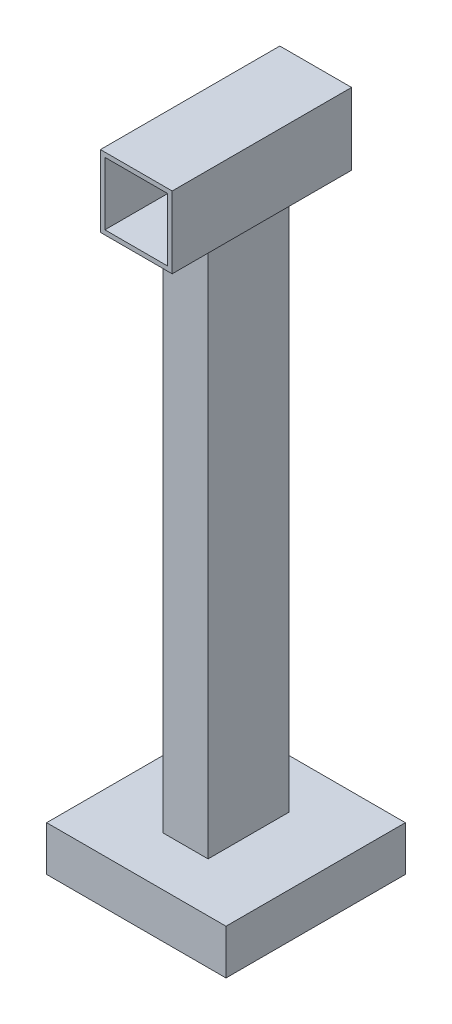
from build123d import *

# Parameters (mm, degrees)
ESQUISSE2_W        = 40
ESQUISSE2_H        = 40
ESQUISSE2_W_2      = 35
ESQUISSE2_H_2      = 35
BOSS_EXTRU_1_DEPTH = 100
ESQUISSE3_W        = 25
ESQUISSE3_H        = 45
BOSS_EXTRU_2_DEPTH = 300
ESQUISSE4_W        = 100
ESQUISSE4_H        = 100
BOSS_EXTRU_3_DEPTH = 25


with BuildPart() as part:
    # Esquisse2 → Boss.-Extru.1 (new body)
    with BuildSketch(Plane.XY):
        Rectangle(ESQUISSE2_W, ESQUISSE2_H)
        Rectangle(ESQUISSE2_W_2, ESQUISSE2_H_2, mode=Mode.SUBTRACT)
    extrude(amount=BOSS_EXTRU_1_DEPTH)

    # Esquisse3 → Boss.-Extru.2 (add)
    with BuildSketch(Plane.XZ.offset(20)):
        with Locations((0, 50)):
            Rectangle(ESQUISSE3_W, ESQUISSE3_H)
    extrude(amount=BOSS_EXTRU_2_DEPTH)

    # Esquisse4 → Boss.-Extru.3 (add)
    with BuildSketch(Plane.XZ.offset(320)):
        with Locations((0, 50)):
            Rectangle(ESQUISSE4_W, ESQUISSE4_H)
    extrude(amount=BOSS_EXTRU_3_DEPTH)


solid = part.part
